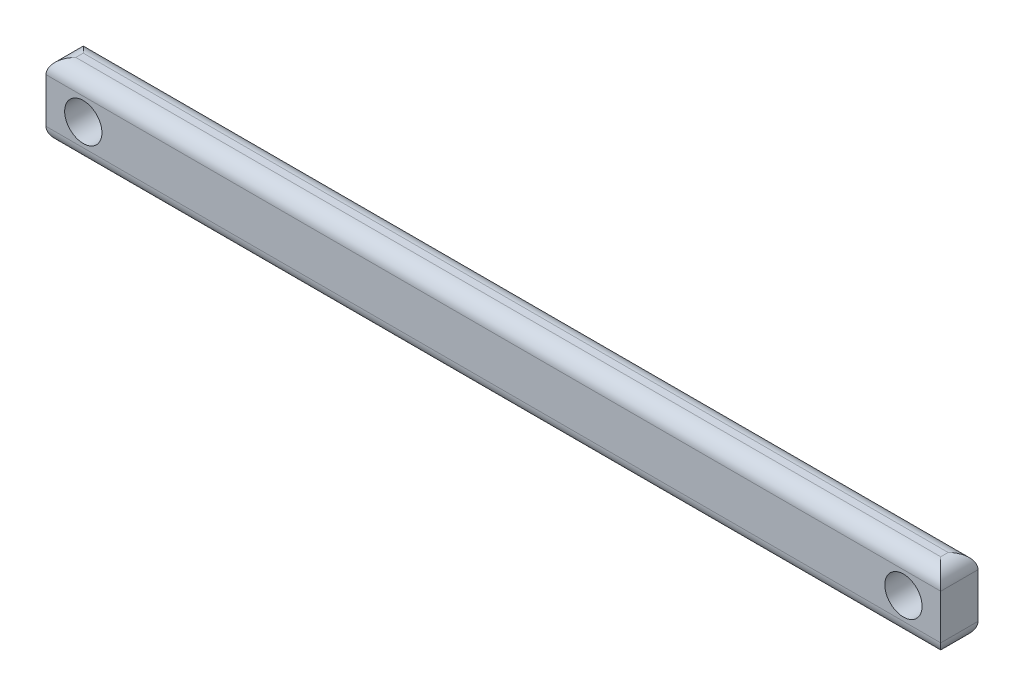
from build123d import *

# Parameters (mm, degrees)
SKETCH1_W           = 600
SKETCH1_H           = 50
SKETCH1_R           = 12.5
BOSS_EXTRUDE2_DEPTH = 25
FILLET2_R           = 10


with BuildPart() as part:
    # Sketch1 → Boss-Extrude2 (new body)
    with BuildSketch(Plane.XY):
        with Locations((-300, 25)):
            Rectangle(SKETCH1_W, SKETCH1_H)
        with Locations((-575, 25)):
            Circle(SKETCH1_R, mode=Mode.SUBTRACT)
        with Locations((-25, 25)):
            Circle(SKETCH1_R, mode=Mode.SUBTRACT)
    extrude(amount=BOSS_EXTRUDE2_DEPTH)

    # Fillet2
    fillet2_edges = [part.edges().sort_by_distance(p)[0] for p in [
        (-300, 0, 25),
        (-300, 0, 0),
        (-300, 50, 0),
        (-300, 50, 25),
        (0, 0, 12.5),
        (-600, 0, 12.5),
        (-600, 50, 12.5),
        (0, 50, 12.5),
    ]]
    fillet(fillet2_edges, radius=FILLET2_R)


solid = part.part
